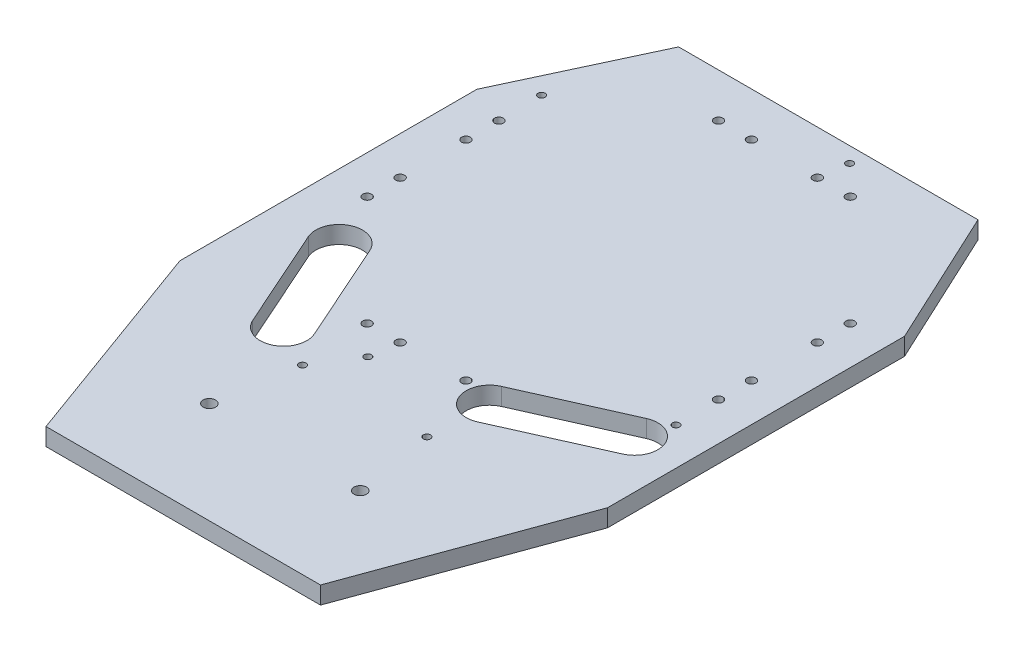
from build123d import *

# Parameters (mm, degrees)
PLATE_DEPTH                  = 6.35
D_GAGEMENT_M32_AT_2_COUNT    = 2
D_GAGEMENT_M32_AT_2_PITCH    = 12
D_GAGEMENT_M32_AT_3_COUNT    = 2
D_GAGEMENT_M32_AT_3_PITCH    = 56.568542495
D_GAGEMENT_M32_AT_4_COUNT    = 2
D_GAGEMENT_M32_AT_4_PITCH    = 65.604877867
R_P_TITION_CIRCULAIRE2_COUNT = 4
D_GAGEMENT_M33_D             = 2.6
D_GAGEMENT_M33_DEPTH         = 6.35
D_GAGEMENT_M33_TIP           = 0.781118805
D_GAGEMENT_M51_D             = 4.54
D_GAGEMENT_M51_DEPTH         = 6.35
D_GAGEMENT_M51_TIP           = 1.363953605
BOLTPATTERNPUCK_D            = 2.6
BOLTPATTERNPUCK_DEPTH        = 6.35
BOLTPATTERNPUCK_TIP          = 0.781118805
ENL_V_MAT_EXTRU_1_DEPTH      = 6.35


with BuildPart() as part:
    # Esquisse3 → Plate (new body)
    with BuildSketch(Plane(origin=(0, 0, 0), x_dir=(1, 0, 0), z_dir=(0, 1, 0))):
        Polygon((-54.533236369, 80), (54.533236369, 80), (77.906839173, 29.875147031), (77.906839173, -78.326589525), (50, -155), (-50, -155), (-77.906839173, -78.326589525), (-77.906839173, 29.875147031), align=None)
    extrude(amount=-PLATE_DEPTH)

    # Esquisse10 → Dégagement M32 (revolve, cut)
    with BuildSketch(Plane(origin=(-24, 0, -64), x_dir=(0, 0, 1), z_dir=(1, 0, 0))):
        Polygon((0, 0), (0, 7.31137699), (1.6, 6.35), (1.6, 0), align=None)
    d_gagement_m32 = revolve(axis=Axis((-24, 6.35, -64), (0, -1, 0)), mode=Mode.SUBTRACT)

    # Dégagement M32 at 2: Dégagement M32 ×2
    with Locations(*[(i * D_GAGEMENT_M32_AT_2_PITCH, 0, 0) for i in range(1, D_GAGEMENT_M32_AT_2_COUNT)]):
        add(d_gagement_m32, mode=Mode.SUBTRACT)

    # Dégagement M32 at 3: Dégagement M32 ×2
    with Locations(*[Vector(-0.7071067811865476, 0, 0.7071067811865475) * (i * D_GAGEMENT_M32_AT_3_PITCH) for i in range(1, D_GAGEMENT_M32_AT_3_COUNT)]):
        add(d_gagement_m32, mode=Mode.SUBTRACT)

    # Dégagement M32 at 4: Dégagement M32 ×2
    with Locations(*[Vector(-0.6097107608496924, 0, 0.7926239891046001) * (i * D_GAGEMENT_M32_AT_4_PITCH) for i in range(1, D_GAGEMENT_M32_AT_4_COUNT)]):
        add(d_gagement_m32, mode=Mode.SUBTRACT)

    # Répétition circulaire2: Dégagement M32 ×4 about axis
    r_p_tition_circulaire2_axis = Axis((0, 0, 0), (0, 1, 0))
    for i in range(1, R_P_TITION_CIRCULAIRE2_COUNT):
        add(d_gagement_m32.rotate(r_p_tition_circulaire2_axis, i * 360 / R_P_TITION_CIRCULAIRE2_COUNT), mode=Mode.SUBTRACT)

    # Répétition circulaire2 copy 1 sketch → Répétition circulaire2 copy 1 (revolve, cut)
    with BuildSketch(Plane(origin=(-64, 0, 12), x_dir=(1, 0, 0), z_dir=(0, 0, -1))):
        Polygon((0, 0), (0, 7.31137699), (1.6, 6.35), (1.6, 0), align=None)
    revolve(axis=Axis((-64, 6.35, 12), (0, -1, 0)), mode=Mode.SUBTRACT)

    # Répétition circulaire2 copy 2 sketch → Répétition circulaire2 copy 2 (revolve, cut)
    with BuildSketch(Plane(origin=(12, 0, 64), x_dir=(0, 0, -1), z_dir=(-1, 0, 0))):
        Polygon((0, 0), (0, 7.31137699), (1.6, 6.35), (1.6, 0), align=None)
    revolve(axis=Axis((12, 6.35, 64), (0, -1, 0)), mode=Mode.SUBTRACT)

    # Répétition circulaire2 copy 3 sketch → Répétition circulaire2 copy 3 (revolve, cut)
    with BuildSketch(Plane(origin=(64, 0, -12), x_dir=(-1, 0, 0), z_dir=(0, 0, 1))):
        Polygon((0, 0), (0, 7.31137699), (1.6, 6.35), (1.6, 0), align=None)
    revolve(axis=Axis((64, 6.35, -12), (0, -1, 0)), mode=Mode.SUBTRACT)

    # Répétition circulaire2 copy 4 sketch → Répétition circulaire2 copy 4 (revolve, cut)
    with BuildSketch(Plane(origin=(-24, 0, 64), x_dir=(1, 0, 0), z_dir=(0, 0, -1))):
        Polygon((0, 0), (0, 7.31137699), (1.6, 6.35), (1.6, 0), align=None)
    revolve(axis=Axis((-24, 6.35, 64), (0, -1, 0)), mode=Mode.SUBTRACT)

    # Répétition circulaire2 copy 5 sketch → Répétition circulaire2 copy 5 (revolve, cut)
    with BuildSketch(Plane(origin=(64, 0, 24), x_dir=(0, 0, -1), z_dir=(-1, 0, 0))):
        Polygon((0, 0), (0, 7.31137699), (1.6, 6.35), (1.6, 0), align=None)
    revolve(axis=Axis((64, 6.35, 24), (0, -1, 0)), mode=Mode.SUBTRACT)

    # Répétition circulaire2 copy 6 sketch → Répétition circulaire2 copy 6 (revolve, cut)
    with BuildSketch(Plane(origin=(24, 0, -64), x_dir=(-1, 0, 0), z_dir=(0, 0, 1))):
        Polygon((0, 0), (0, 7.31137699), (1.6, 6.35), (1.6, 0), align=None)
    revolve(axis=Axis((24, 6.35, -64), (0, -1, 0)), mode=Mode.SUBTRACT)

    # Répétition circulaire2 copy 7 sketch → Répétition circulaire2 copy 7 (revolve, cut)
    with BuildSketch(Plane(origin=(-12, 0, 64), x_dir=(1, 0, 0), z_dir=(0, 0, -1))):
        Polygon((0, 0), (0, 7.31137699), (1.6, 6.35), (1.6, 0), align=None)
    revolve(axis=Axis((-12, 6.35, 64), (0, -1, 0)), mode=Mode.SUBTRACT)

    # Répétition circulaire2 copy 8 sketch → Répétition circulaire2 copy 8 (revolve, cut)
    with BuildSketch(Plane(origin=(64, 0, 12), x_dir=(0, 0, -1), z_dir=(-1, 0, 0))):
        Polygon((0, 0), (0, 7.31137699), (1.6, 6.35), (1.6, 0), align=None)
    revolve(axis=Axis((64, 6.35, 12), (0, -1, 0)), mode=Mode.SUBTRACT)

    # Répétition circulaire2 copy 9 sketch → Répétition circulaire2 copy 9 (revolve, cut)
    with BuildSketch(Plane(origin=(12, 0, -64), x_dir=(-1, 0, 0), z_dir=(0, 0, 1))):
        Polygon((0, 0), (0, 7.31137699), (1.6, 6.35), (1.6, 0), align=None)
    revolve(axis=Axis((12, 6.35, -64), (0, -1, 0)), mode=Mode.SUBTRACT)

    # Dégagement M33
    with Locations(Plane(origin=(0, 0, 0), x_dir=(1, 0, 0), z_dir=(0, 1, 0))):
        with Locations((13.379268261, 74.387466557), (-64.260298072, 39.788366286), (-13.379268261, -74.387466557), (64.260298072, -39.788366286)):
            Hole(D_GAGEMENT_M33_D / 2, depth=D_GAGEMENT_M33_DEPTH)
            with Locations((0, 0, -(D_GAGEMENT_M33_DEPTH + D_GAGEMENT_M33_TIP / 2))):  # 118° drill point
                Cone(0, D_GAGEMENT_M33_D / 2, D_GAGEMENT_M33_TIP, mode=Mode.SUBTRACT)

    # Dégagement M51
    with Locations(Plane(origin=(0, 0, 0), x_dir=(1, 0, 0), z_dir=(0, 1, 0))):
        with Locations((-27.48, -118), (27.48, -118)):
            Hole(D_GAGEMENT_M51_D / 2, depth=D_GAGEMENT_M51_DEPTH)
            with Locations((0, 0, -(D_GAGEMENT_M51_DEPTH + D_GAGEMENT_M51_TIP / 2))):  # 118° drill point
                Cone(0, D_GAGEMENT_M51_D / 2, D_GAGEMENT_M51_TIP, mode=Mode.SUBTRACT)

    # BoltPatternPuck
    with Locations(Plane(origin=(-22.655, 0, 88.899176296), x_dir=(0, 0, 1), z_dir=(0, 1, 0))):
        with Locations((0, 0), (0, 45.31)):
            Hole(BOLTPATTERNPUCK_D / 2, depth=BOLTPATTERNPUCK_DEPTH)
            with Locations((0, 0, -(BOLTPATTERNPUCK_DEPTH + BOLTPATTERNPUCK_TIP / 2))):  # 118° drill point
                Cone(0, BOLTPATTERNPUCK_D / 2, BOLTPATTERNPUCK_TIP, mode=Mode.SUBTRACT)

    # Esquisse19 → Enlèv. mat.-Extru.1 (cut)
    with BuildSketch(Plane(origin=(0, 0, 0), x_dir=(1, 0, 0), z_dir=(0, 1, 0))):
        with BuildLine():
            Line((20.271956718, -59.39121964), (56.808223228, -43.1092901))
            ThreePointArc((56.808223228, -43.1092901), (68.032089888, -47.413336706), (63.728043282, -58.637203367))
            Line((63.728043282, -58.637203367), (27.191776772, -74.919132906))
            ThreePointArc((27.191776772, -74.919132906), (15.967910112, -70.6150863), (20.271956718, -59.39121964))
        make_face()
        with BuildLine():
            Line((-46.588263316, -40.402999759), (-30.306333777, -76.939266269))
            ThreePointArc((-30.306333777, -76.939266269), (-34.610380383, -88.163132929), (-45.834247043, -83.859086323))
            Line((-45.834247043, -83.859086323), (-62.116176583, -47.322819813))
            ThreePointArc((-62.116176583, -47.322819813), (-57.812129976, -36.098953153), (-46.588263316, -40.402999759))
        make_face()
    extrude(amount=-ENL_V_MAT_EXTRU_1_DEPTH, mode=Mode.SUBTRACT)


solid = part.part
